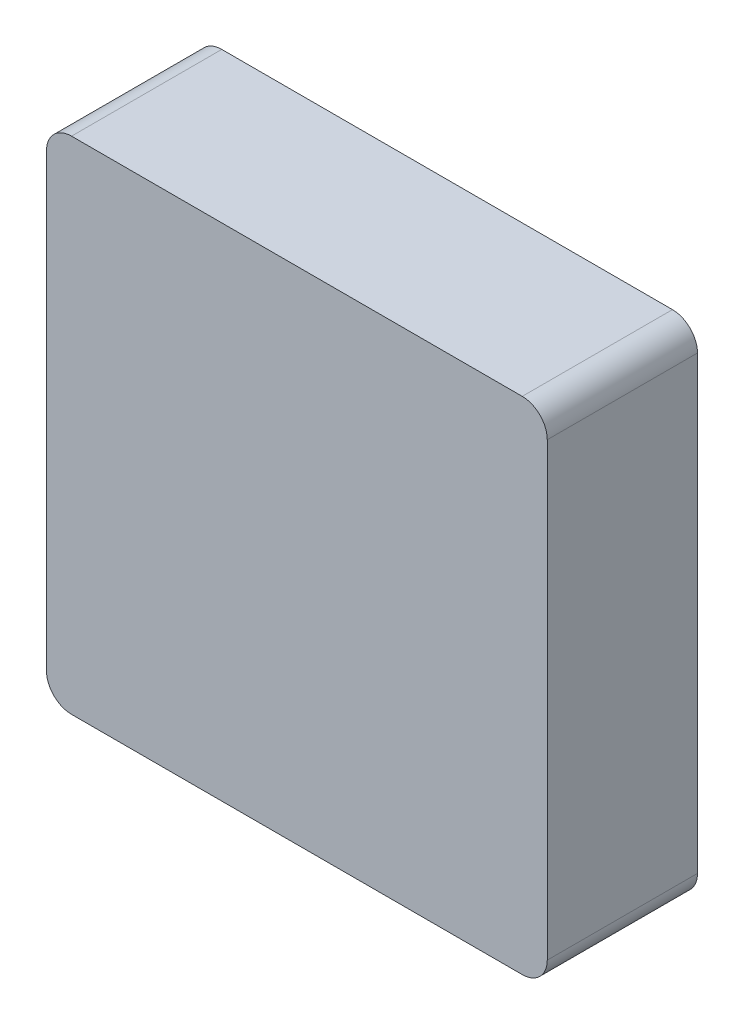
from build123d import *

# Parameters (mm, degrees)
BOSS_EXTRUDE1_DEPTH = 30


with BuildPart() as part:
    # Sketch1 → Boss-Extrude1 (new body)
    with BuildSketch(Plane.XY):
        with BuildLine():
            Line((-45, -50), (45, -50))
            ThreePointArc((45, -50), (48.535533906, -48.535533906), (50, -45))
            Line((50, -45), (50, 45))
            ThreePointArc((50, 45), (48.535533906, 48.535533906), (45, 50))
            Line((45, 50), (-45, 50))
            ThreePointArc((-45, 50), (-48.535533906, 48.535533906), (-50, 45))
            Line((-50, 45), (-50, -45))
            ThreePointArc((-50, -45), (-48.535533906, -48.535533906), (-45, -50))
        make_face()
    extrude(amount=BOSS_EXTRUDE1_DEPTH)


solid = part.part
